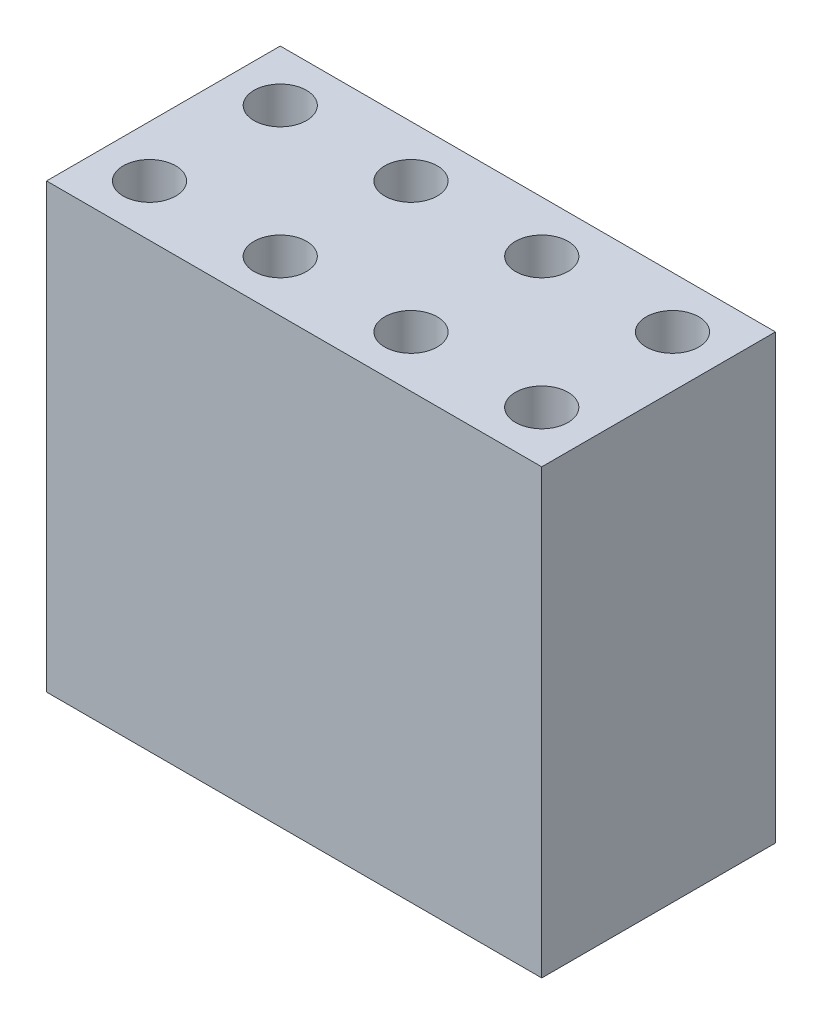
from build123d import *

# Parameters (mm, degrees)
ESBO_O2_W                = 9.61994
ESBO_O2_H                = 4.54
ESBO_O2_R                = 0.51
RESSALTO_EXTRUS_O2_DEPTH = 8.6


with BuildPart() as part:
    # Esboço2 → Ressalto-extrusão2 (new body)
    with BuildSketch(Plane(origin=(0, 0, 0), x_dir=(1, 0, 0), z_dir=(0, 1, 0))):
        Rectangle(ESBO_O2_W, ESBO_O2_H)
        with Locations(Location((-3.81, -1.27, 0), (0, 0, 270))):
            Circle(ESBO_O2_R, mode=Mode.SUBTRACT)
        with Locations(Location((-1.27001, -1.27, 0), (0, 0, 270))):
            Circle(ESBO_O2_R, mode=Mode.SUBTRACT)
        with Locations(Location((1.26998, -1.27, 0), (0, 0, 270))):
            Circle(ESBO_O2_R, mode=Mode.SUBTRACT)
        with Locations(Location((3.80997, -1.27, 0), (0, 0, 270))):
            Circle(ESBO_O2_R, mode=Mode.SUBTRACT)
        with Locations(Location((3.80997, 1.27, 0), (0, 0, 90))):
            Circle(ESBO_O2_R, mode=Mode.SUBTRACT)
        with Locations(Location((1.26998, 1.27, 0), (0, 0, 90))):
            Circle(ESBO_O2_R, mode=Mode.SUBTRACT)
        with Locations(Location((-1.27001, 1.27, 0), (0, 0, 90))):
            Circle(ESBO_O2_R, mode=Mode.SUBTRACT)
        with Locations(Location((-3.81, 1.27, 0), (0, 0, 90))):
            Circle(ESBO_O2_R, mode=Mode.SUBTRACT)
    extrude(amount=RESSALTO_EXTRUS_O2_DEPTH)


solid = part.part
